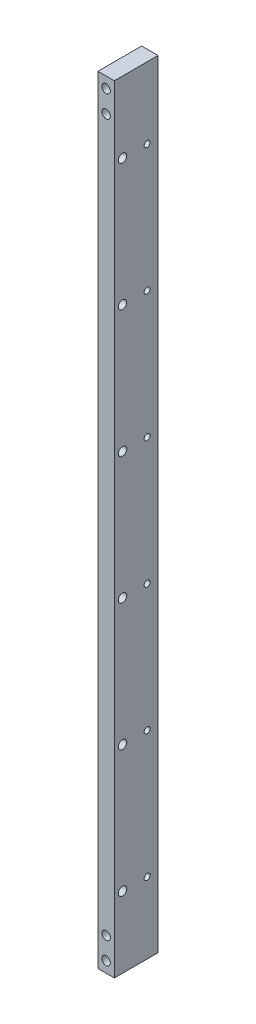
from build123d import *

# Parameters (mm, degrees)
SKETCH1_W                                      = 9.525
SKETCH1_H                                      = 25.4
BOSS_EXTRUDE1_DEPTH                            = 450.85
CBORE_FOR_8_SOCKET_HEAD_CAP_SCREW1_D           = 4.9149
CBORE_FOR_8_SOCKET_HEAD_CAP_SCREW1_CBORE_D     = 7.9375
CBORE_FOR_8_SOCKET_HEAD_CAP_SCREW1_CBORE_DEPTH = 5.4356
CBORE_FOR_8_SOCKET_HEAD_CAP_SCREW2_D           = 4.9149
CBORE_FOR_8_SOCKET_HEAD_CAP_SCREW2_CBORE_D     = 7.9375
CBORE_FOR_8_SOCKET_HEAD_CAP_SCREW2_CBORE_DEPTH = 16.8656
F_8_32_TAPPED_HOLE1_D                          = 3.4544


with BuildPart() as part:
    # Sketch1 → Boss-Extrude1 (new body)
    with BuildSketch(Plane(origin=(0, 0, 0), x_dir=(1, 0, 0), z_dir=(0, 1, 0))):
        with Locations((-8.211890298, -2.158307883)):
            Rectangle(SKETCH1_W, SKETCH1_H)
    extrude(amount=BOSS_EXTRUDE1_DEPTH)

    # CBORE for #8 Socket Head Cap Screw1 (through all)
    with Locations(Plane.ZY.offset(12.974390298)):
        with Locations((10.095807883, 41.275), (10.095807883, 114.935), (10.095807883, 188.595), (10.095807883, 262.255), (10.095807883, 335.915), (10.095807883, 409.575)):
            CounterBoreHole(CBORE_FOR_8_SOCKET_HEAD_CAP_SCREW1_D / 2, CBORE_FOR_8_SOCKET_HEAD_CAP_SCREW1_CBORE_D / 2, CBORE_FOR_8_SOCKET_HEAD_CAP_SCREW1_CBORE_DEPTH)

    # CBORE for #8 Socket Head Cap Screw2 (through all)
    with Locations(Plane(origin=(0, 0, -10.541692117), x_dir=(-1, 0, 0), z_dir=(0, 0, -1))):
        with Locations((8.211890298, 6.35), (8.211890298, 19.05), (8.211890298, 431.8), (8.211890298, 444.5)):
            CounterBoreHole(CBORE_FOR_8_SOCKET_HEAD_CAP_SCREW2_D / 2, CBORE_FOR_8_SOCKET_HEAD_CAP_SCREW2_CBORE_D / 2, CBORE_FOR_8_SOCKET_HEAD_CAP_SCREW2_CBORE_DEPTH)

    # #8-32 Tapped Hole1 (through all)
    with Locations(Plane.ZY.offset(12.974390298)):
        with Locations((-4.191692117, 41.275), (-4.191692117, 114.935), (-4.191692117, 188.595), (-4.191692117, 262.255), (-4.191692117, 335.915), (-4.191692117, 409.575)):
            Hole(F_8_32_TAPPED_HOLE1_D / 2)


solid = part.part
